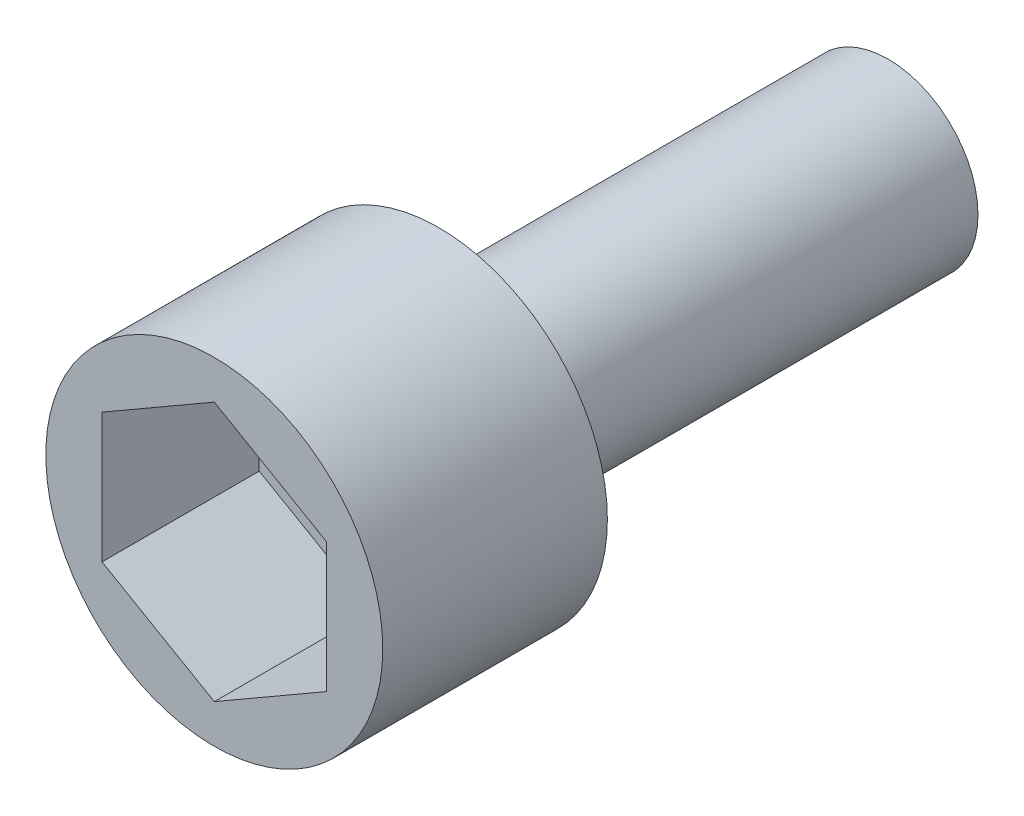
from build123d import *

# Parameters (mm, degrees)
SKETCH1_R           = 7.5
BOSS_EXTRUDE1_DEPTH = 10
SKETCH3_R           = 4
BOSS_EXTRUDE2_DEPTH = 20
CUT_EXTRUDE1_DEPTH  = 7


with BuildPart() as part:
    # Sketch1 → Boss-Extrude1 (new body)
    with BuildSketch(Plane.XY):
        Circle(SKETCH1_R)
    extrude(amount=BOSS_EXTRUDE1_DEPTH)

    # Sketch3 → Boss-Extrude2 (add)
    with BuildSketch(Plane(origin=(0, 0, 0), x_dir=(-1, 0, 0), z_dir=(0, 0, -1))):
        Circle(SKETCH3_R)
    extrude(amount=BOSS_EXTRUDE2_DEPTH)

    # Sketch2 → Cut-Extrude1 (cut)
    with BuildSketch(Plane.XY.offset(10)):
        Polygon((5, 2.886751346), (0, 5.773502692), (-5, 2.886751346), (-5, -2.886751346), (0, -5.773502692), (5, -2.886751346), align=None)
    extrude(amount=-CUT_EXTRUDE1_DEPTH, mode=Mode.SUBTRACT)


solid = part.part
